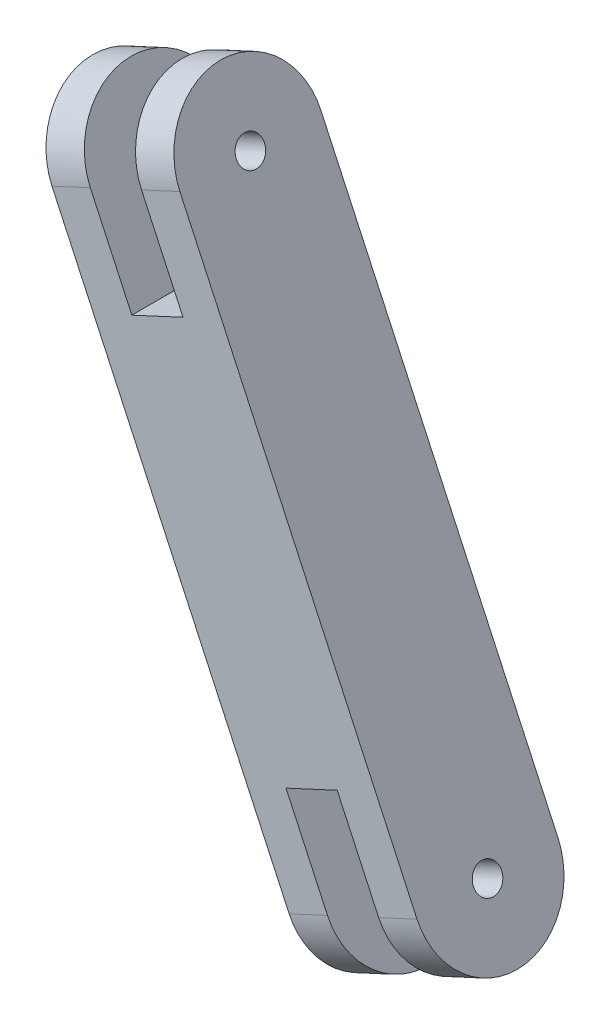
from build123d import *

# Parameters (mm, degrees)
BOSS_EXTRU_1_DEPTH      = 10
ESQUISSE2_R             = 1
ENL_V_MAT_EXTRU_1_DEPTH = 20


with BuildPart() as part:
    # Esquisse1 → Boss.-Extru.1 (new body)
    with BuildSketch(Plane.XY):
        Polygon((-99.151357472, 118.130872671), (-101.873142366, 116.869172631), (-80.844808358, 71.506091068), (-78.123023465, 72.767791109), (-83.169823626, 83.654930684), (-79.540777101, 85.337197404), (-74.49397694, 74.450057829), (-71.772192046, 75.71175787), (-92.800526053, 121.074839432), (-95.522310947, 119.813139392), (-90.475510785, 108.925999817), (-94.10455731, 107.243733096), align=None)
    extrude(amount=BOSS_EXTRU_1_DEPTH)

    # Esquisse2 → Enlèv. mat.-Extru.1 (cut)
    with BuildSketch(Plane(origin=(-39.261124148, -18.199734313, 0), x_dir=(0, 0, 1), z_dir=(-0.9072616312569982, -0.42056668014583676, 0))):
        with BuildLine():
            ThreePointArc((0, 143.875365486), (1.464466094, 147.410899392), (5, 148.875365486))
            Line((5, 148.875365486), (0, 148.875365486))
            Line((0, 148.875365486), (0, 143.875365486))
        make_face()
        with BuildLine():
            ThreePointArc((5, 148.875365486), (8.535533906, 147.410899392), (10, 143.875365486))
            Line((10, 143.875365486), (10, 148.875365486))
            Line((10, 148.875365486), (5, 148.875365486))
        make_face()
        with Locations(Location((5, 143.875365486, 0), (0, 0, 270))):
            Circle(ESQUISSE2_R)
        with BuildLine():
            Line((10, 98.875365486), (10, 103.875365486))
            ThreePointArc((10, 103.875365486), (8.535533906, 100.33983158), (5, 98.875365486))
            Line((5, 98.875365486), (10, 98.875365486))
        make_face()
        with BuildLine():
            Line((0, 98.875365486), (5, 98.875365486))
            ThreePointArc((5, 98.875365486), (1.464466094, 100.33983158), (0, 103.875365486))
            Line((0, 103.875365486), (0, 98.875365486))
        make_face()
        with Locations(Location((5, 103.875365486, 0), (0, 0, 270))):
            Circle(ESQUISSE2_R)
    extrude(amount=-ENL_V_MAT_EXTRU_1_DEPTH, mode=Mode.SUBTRACT)


solid = part.part
